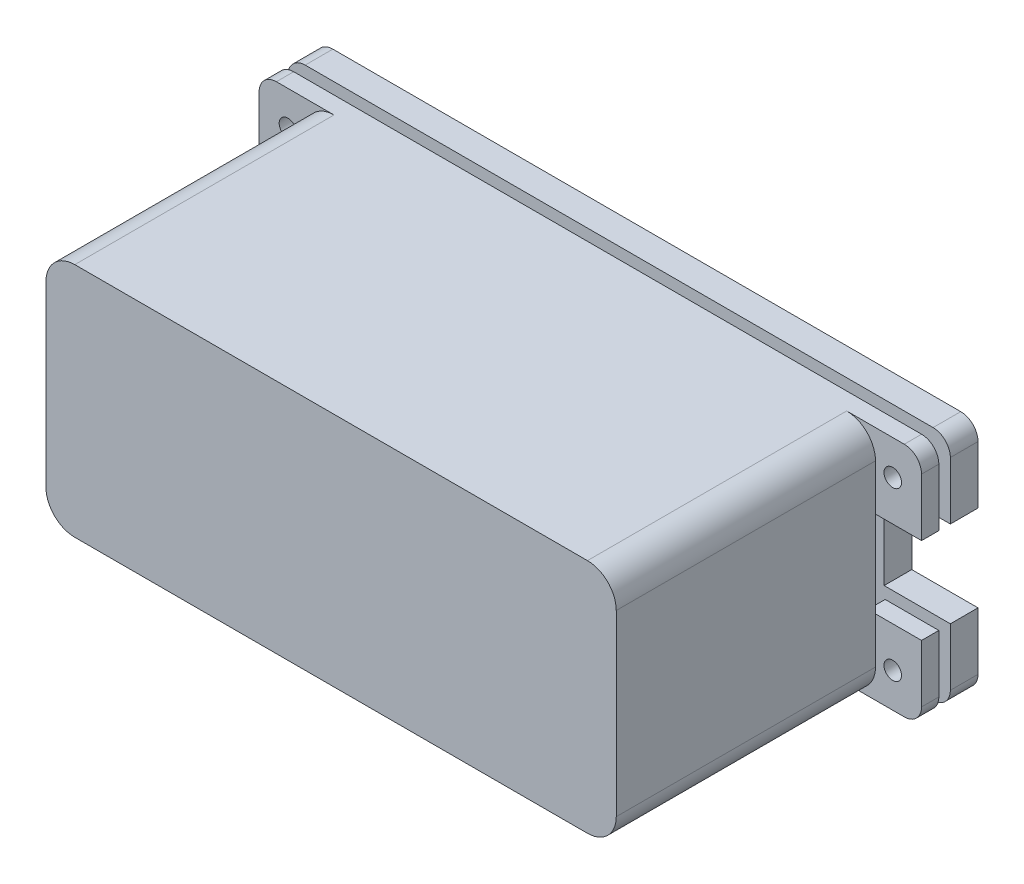
from build123d import *

# Parameters (mm, degrees)
SKETCH_1_W          = 115
SKETCH_1_H          = 41
EXTRUDE_1_DEPTH     = 4.8
FILLET_1_R          = 3
SKETCH_2_R          = 1.52
SKETCH_2_W          = 13
SKETCH_2_H          = 15
CUT_EXTRUDE_1_DEPTH = 55
EXTRUDE_2_DEPTH     = 3
SKETCH_5_W          = 99
SKETCH_5_H          = 41
EXTRUDE_3_DEPTH     = 45
SKETCH_7_R          = 1.52
CUT_EXTRUDE_2_DEPTH = 45
FILLET_2_R          = 5
CUT_EXTRUDE_4_DEPTH = 43
SKETCH_9_W          = 5
SKETCH_9_H          = 15
CUT_EXTRUDE_5_DEPTH = 9.8


with BuildPart() as part:
    # 草图1 → 凸台-拉伸1 (new body)
    with BuildSketch(Plane.XY):
        Rectangle(SKETCH_1_W, SKETCH_1_H)
    extrude(amount=EXTRUDE_1_DEPTH)

    # 圆角1
    fillet_1_edges = [part.edges().sort_by_distance(p)[0] for p in [
        (57.5, -20.5, 2.4),
        (-57.5, -20.5, 2.4),
        (-57.5, 20.5, 2.4),
        (57.5, 20.5, 2.4),
    ]]
    fillet(fillet_1_edges, radius=FILLET_1_R)

    # 草图2 → 切除-拉伸1 (cut)
    with BuildSketch(Plane.XY.offset(4.8)):
        with Locations((52.5, 14.5)):
            Circle(SKETCH_2_R)
        with Locations((-52.5, 14.5)):
            Circle(SKETCH_2_R)
        with Locations((-52.5, -14.5)):
            Circle(SKETCH_2_R)
        with Locations((52.5, -14.5)):
            Circle(SKETCH_2_R)
        with Locations((57.5, 0)):
            Rectangle(SKETCH_2_W, SKETCH_2_H)
    extrude(amount=-CUT_EXTRUDE_1_DEPTH, mode=Mode.SUBTRACT)


with BuildPart() as body_2:
    # 草图4 → 凸台-拉伸2 (new body)
    with BuildSketch(Plane.XY.offset(6.8)):
        with BuildLine():
            Line((57.5, -17.5), (57.5, -7.5))
            Line((57.5, -7.5), (51, -7.5))
            Line((51, -7.5), (51, 7.5))
            Line((51, 7.5), (57.5, 7.5))
            Line((57.5, 7.5), (57.5, 17.5))
            ThreePointArc((57.5, 17.5), (56.621320344, 19.621320344), (54.5, 20.5))
            Line((54.5, 20.5), (-54.5, 20.5))
            ThreePointArc((-54.5, 20.5), (-56.621320344, 19.621320344), (-57.5, 17.5))
            Line((-57.5, 17.5), (-57.5, -17.5))
            ThreePointArc((-57.5, -17.5), (-56.621320344, -19.621320344), (-54.5, -20.5))
            Line((-54.5, -20.5), (54.5, -20.5))
            ThreePointArc((54.5, -20.5), (56.621320344, -19.621320344), (57.5, -17.5))
        make_face()
    extrude(amount=EXTRUDE_2_DEPTH)

    # 草图5 → 凸台-拉伸3 (add)
    with BuildSketch(Plane.XY.offset(9.8)):
        Rectangle(SKETCH_5_W, SKETCH_5_H)
    extrude(amount=EXTRUDE_3_DEPTH)

    # 草图7 → 切除-拉伸2 (cut)
    with BuildSketch(Plane.XY.offset(9.8)):
        with Locations((-52.5, -14.5)):
            Circle(SKETCH_7_R)
        with Locations((-52.5, 14.5)):
            Circle(SKETCH_7_R)
        with Locations((52.5, -14.5)):
            Circle(SKETCH_7_R)
        with Locations((52.5, 14.5)):
            Circle(SKETCH_7_R)
    extrude(amount=-CUT_EXTRUDE_2_DEPTH, mode=Mode.SUBTRACT)

    # 圆角2
    fillet_2_edges = [body_2.edges().sort_by_distance(p)[0] for p in [
        (49.5, -20.5, 32.3),
        (49.5, 20.5, 32.3),
        (-49.5, 20.5, 32.3),
        (-49.5, -20.5, 32.3),
    ]]
    fillet(fillet_2_edges, radius=FILLET_2_R)

    # 草图8 → 切除-拉伸4 (cut)
    with BuildSketch(Plane(origin=(0, 0, 6.8), x_dir=(-1, 0, 0), z_dir=(0, 0, -1))):
        with BuildLine():
            Line((-48.18, 15.5), (-48.18, -15.5))
            ThreePointArc((-48.18, -15.5), (-47.102152955, -18.102152955), (-44.5, -19.18))
            Line((-44.5, -19.18), (44.5, -19.18))
            ThreePointArc((44.5, -19.18), (47.102152955, -18.102152955), (48.18, -15.5))
            Line((48.18, -15.5), (48.18, 15.5))
            ThreePointArc((48.18, 15.5), (47.102152955, 18.102152955), (44.5, 19.18))
            Line((44.5, 19.18), (-44.5, 19.18))
            ThreePointArc((-44.5, 19.18), (-47.102152955, 18.102152955), (-48.18, 15.5))
        make_face()
    extrude(amount=-CUT_EXTRUDE_4_DEPTH, mode=Mode.SUBTRACT)


with BuildPart() as cut_extrude_5_tool:
    # 草图9 → 切除-拉伸5 (new body)
    with BuildSketch(Plane(origin=(0, 0, 0), x_dir=(-1, 0, 0), z_dir=(0, 0, -1))):
        with Locations((-48.5, 0)):
            Rectangle(SKETCH_9_W, SKETCH_9_H)
    extrude(amount=-CUT_EXTRUDE_5_DEPTH)


with BuildPart() as part_1:
    add(part.part)

    # 切除-拉伸5: cut by cut_extrude_5_tool
    add(cut_extrude_5_tool.part, mode=Mode.SUBTRACT)


with BuildPart() as body_2_1:
    add(body_2.part)

    # 切除-拉伸5: cut by cut_extrude_5_tool
    add(cut_extrude_5_tool.part, mode=Mode.SUBTRACT)


solid = Compound([part_1.part, body_2_1.part])
